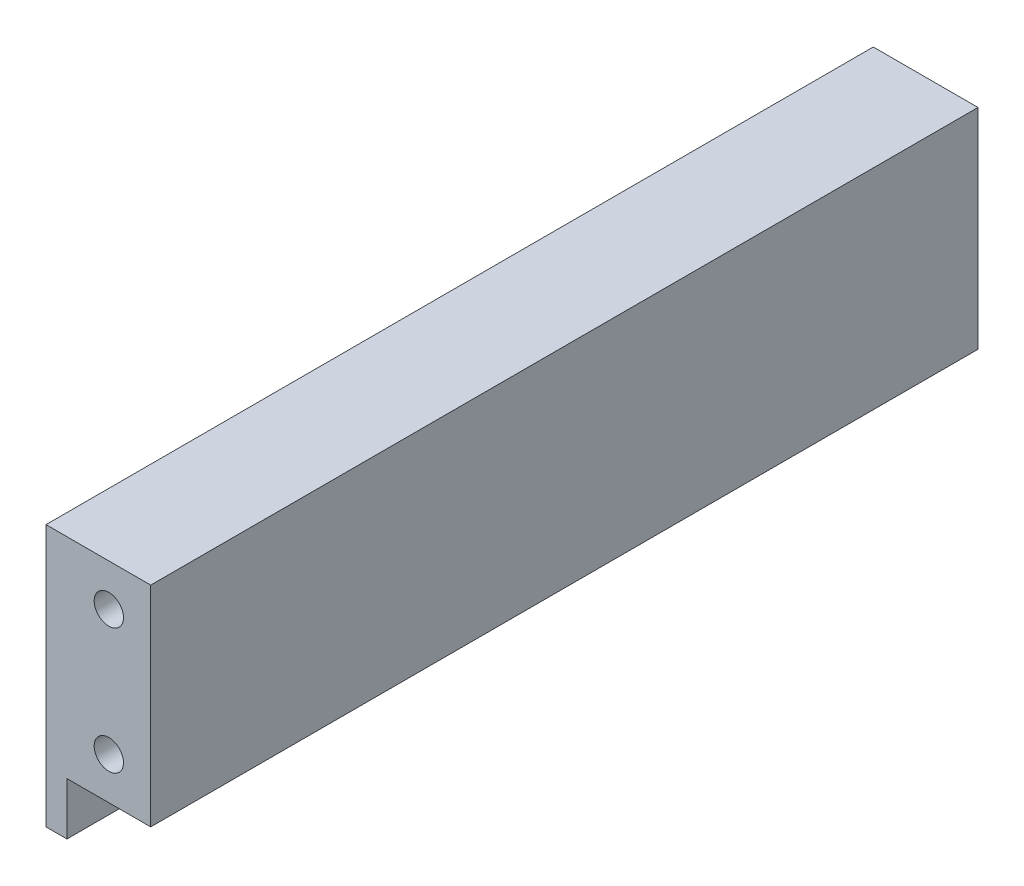
from build123d import *

# Parameters (mm, degrees)
BOSS_EXTRUDE1_DEPTH = 79
SKETCH2_R           = 1.4
CUT_EXTRUDE1_DEPTH  = 79


with BuildPart() as part:
    # Sketch1 → Boss-Extrude1 (new body)
    with BuildSketch(Plane.XY):
        Polygon((-4, 10), (-6, 10), (-6, -15), (-4, -15), (-4, -10), (4, -10), (4, 10), align=None)
    extrude(amount=BOSS_EXTRUDE1_DEPTH)

    # Sketch2 → Cut-Extrude1 (cut)
    with BuildSketch(Plane(origin=(0, 0, 0), x_dir=(-1, 0, 0), z_dir=(0, 0, -1))):
        with Locations((0, 6)):
            Circle(SKETCH2_R)
        with Locations((0, -6)):
            Circle(SKETCH2_R)
    extrude(amount=-CUT_EXTRUDE1_DEPTH, mode=Mode.SUBTRACT)


solid = part.part
